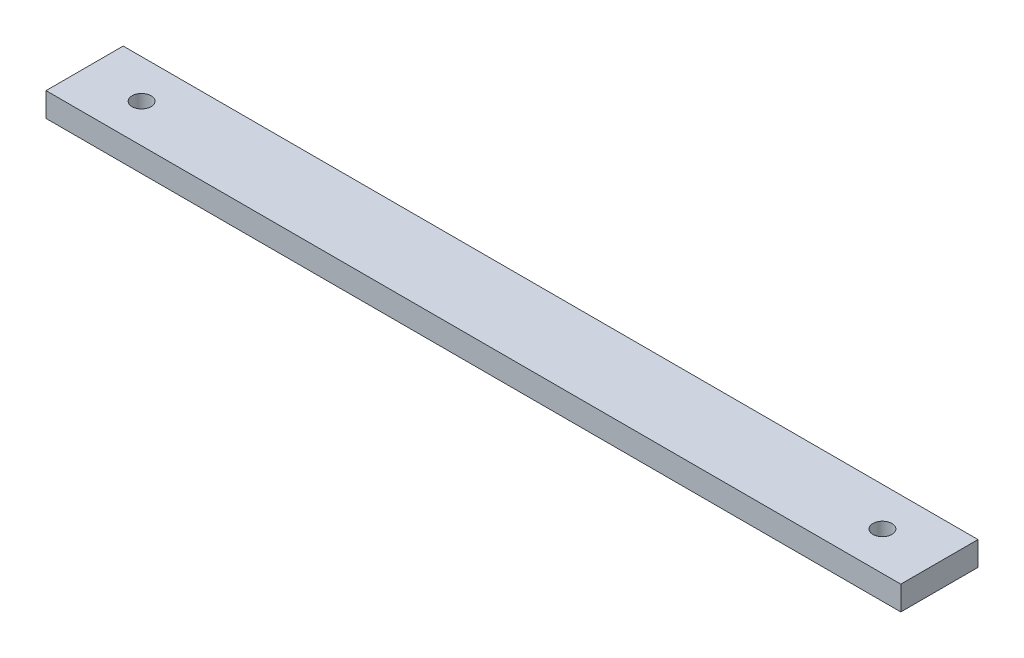
from build123d import *

# Parameters (mm, degrees)
SKETCH1_W           = 225
SKETCH1_H           = 20.32
SKETCH1_R           = 2.5
BOSS_EXTRUDE1_DEPTH = 6.35


with BuildPart() as part:
    # Sketch1 → Boss-Extrude1 (new body)
    with BuildSketch(Plane(origin=(0, 0, 0), x_dir=(1, 0, 0), z_dir=(0, 1, 0))):
        with Locations((112.5, 10.16)):
            Rectangle(SKETCH1_W, SKETCH1_H)
        with Locations(Location((15, 10.16, 0), (0, 0, 270))):
            Circle(SKETCH1_R, mode=Mode.SUBTRACT)
        with Locations(Location((210, 10.16, 0), (0, 0, 90))):
            Circle(SKETCH1_R, mode=Mode.SUBTRACT)
    extrude(amount=BOSS_EXTRUDE1_DEPTH)


solid = part.part
